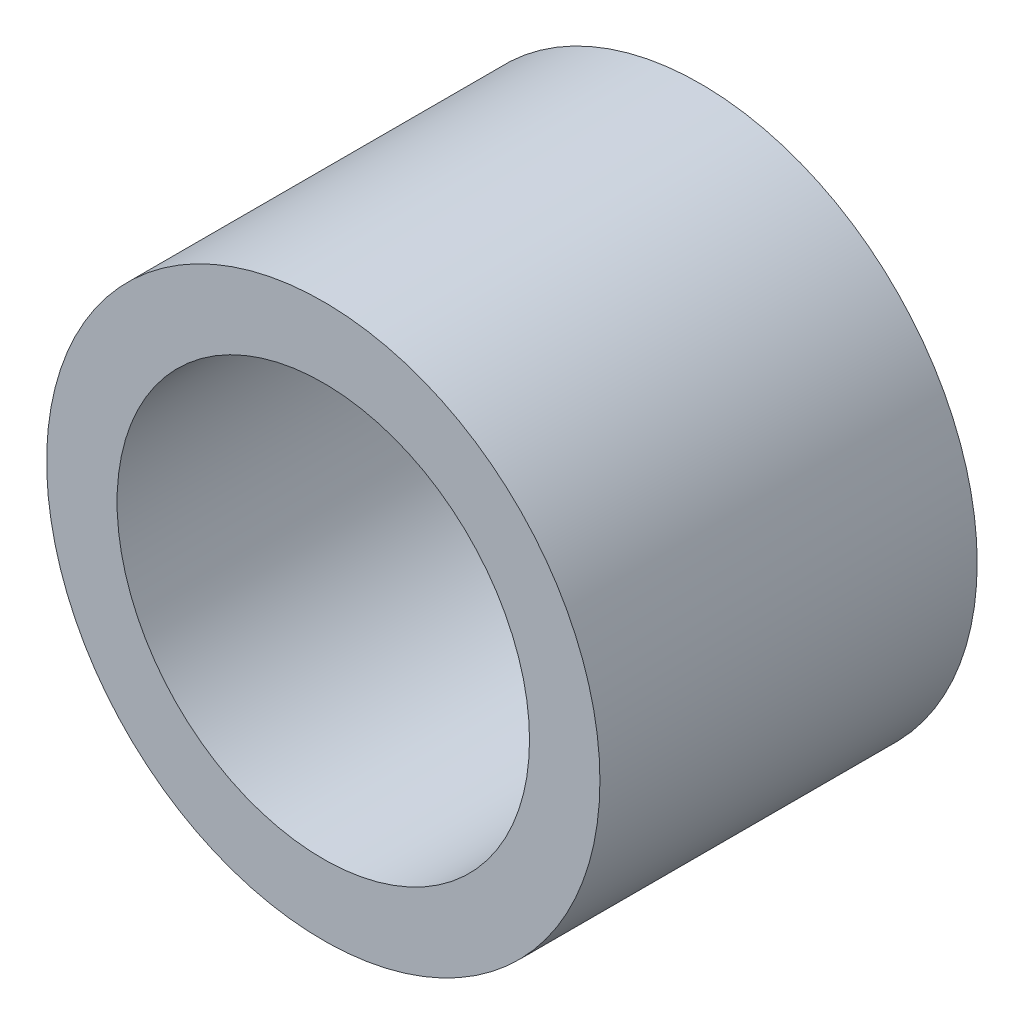
from build123d import *

# Parameters (mm, degrees)
SKETCH1_R           = 5.5
SKETCH1_R_2         = 4.1
BOSS_EXTRUDE1_DEPTH = 7.5


with BuildPart() as part:
    # Sketch1 → Boss-Extrude1 (new body)
    with BuildSketch(Plane.XY):
        Circle(SKETCH1_R)
        Circle(SKETCH1_R_2, mode=Mode.SUBTRACT)
    extrude(amount=BOSS_EXTRUDE1_DEPTH)


solid = part.part
